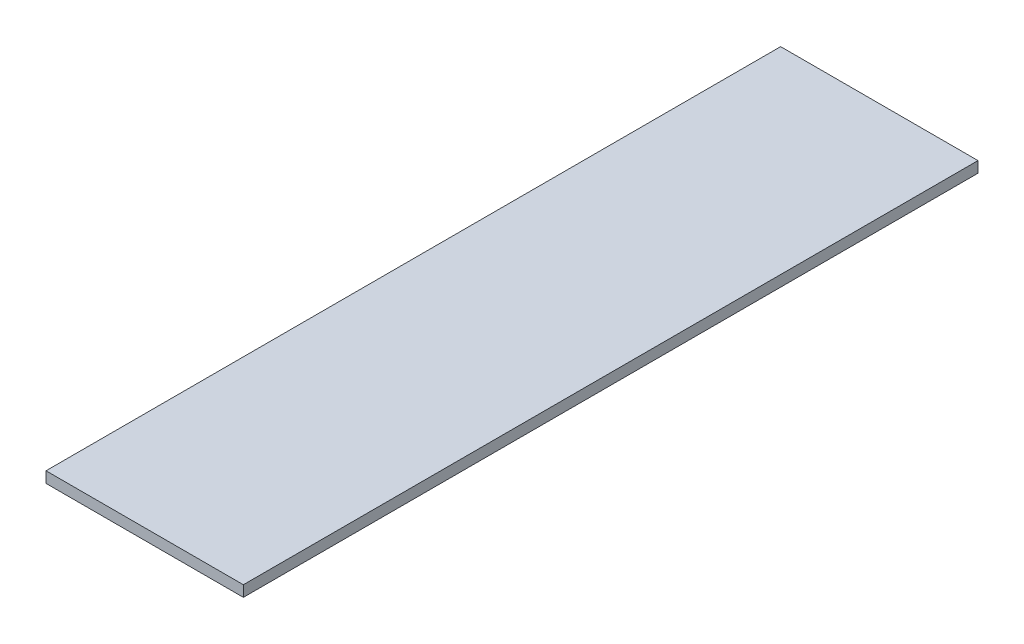
from build123d import *

# Parameters (mm, degrees)
SKETCH1_W           = 57.15
SKETCH1_H           = 212.725
BOSS_EXTRUDE1_DEPTH = 3.175


with BuildPart() as part:
    # Sketch1 → Boss-Extrude1 (new body)
    with BuildSketch(Plane(origin=(0, 0, 0), x_dir=(1, 0, 0), z_dir=(0, 1, 0))):
        with Locations((28.575, 106.3625)):
            Rectangle(SKETCH1_W, SKETCH1_H)
    extrude(amount=BOSS_EXTRUDE1_DEPTH)


solid = part.part
